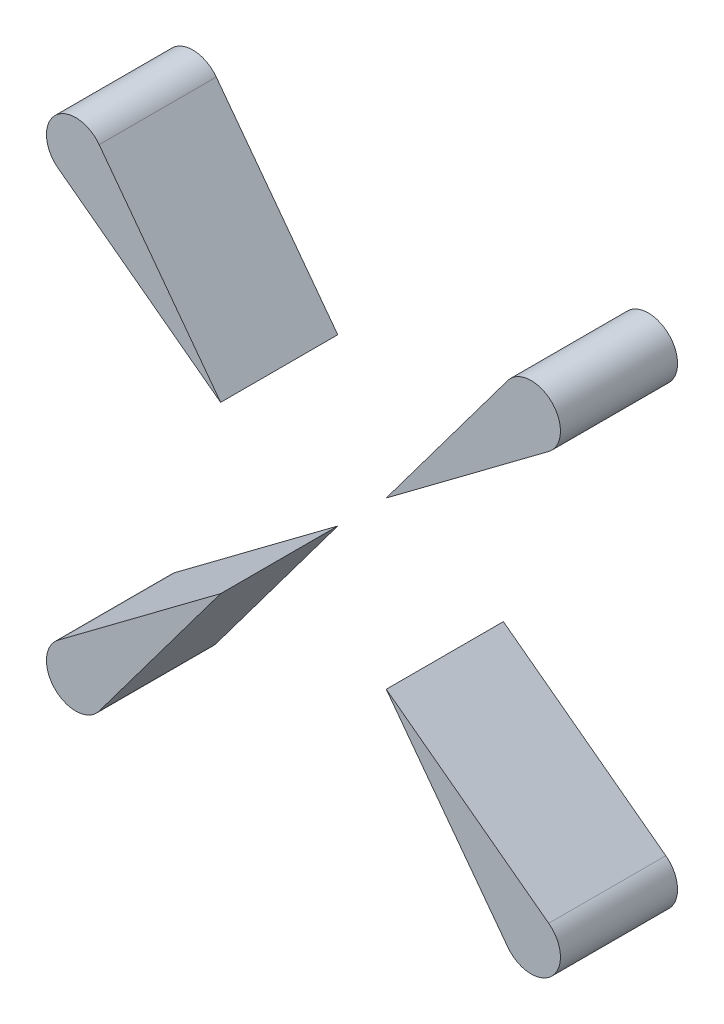
from build123d import *

# Parameters (mm, degrees)
BOSS_EXTRUDE1_DEPTH   = 1
BOSS_EXTRUDE1_2_DEPTH = 1
BOSS_EXTRUDE1_3_DEPTH = 1
BOSS_EXTRUDE1_4_DEPTH = 1


with BuildPart() as part:
    # Sketch1 → Boss-Extrude1 (new body)
    with BuildSketch(Plane.XY):
        with BuildLine():
            Line((0.707106781, 0.707106781), (1.744326282, 2.094253388))
            ThreePointArc((1.744326282, 2.094253388), (2.121320344, 2.121320344), (2.094253388, 1.744326282))
            Line((2.094253388, 1.744326282), (0.707106781, 0.707106781))
        make_face()
    extrude(amount=BOSS_EXTRUDE1_DEPTH)


with BuildPart() as body_2:
    # Sketch1 → Boss-Extrude1 2 (new body)
    with BuildSketch(Plane.XY):
        with BuildLine():
            Line((1.744326282, -2.094253388), (0.707106781, -0.707106781))
            Line((0.707106781, -0.707106781), (2.094253388, -1.744326282))
            ThreePointArc((2.094253388, -1.744326282), (2.121320344, -2.121320344), (1.744326282, -2.094253388))
        make_face()
    extrude(amount=BOSS_EXTRUDE1_2_DEPTH)


with BuildPart() as body_3:
    # Sketch1 → Boss-Extrude1 3 (new body)
    with BuildSketch(Plane.XY):
        with BuildLine():
            Line((-2.094253388, -1.744326282), (-0.707106781, -0.707106781))
            Line((-0.707106781, -0.707106781), (-1.744326282, -2.094253388))
            ThreePointArc((-1.744326282, -2.094253388), (-2.121320344, -2.121320344), (-2.094253388, -1.744326282))
        make_face()
    extrude(amount=BOSS_EXTRUDE1_3_DEPTH)


with BuildPart() as body_4:
    # Sketch1 → Boss-Extrude1 4 (new body)
    with BuildSketch(Plane.XY):
        with BuildLine():
            Line((-1.744326282, 2.094253388), (-0.707106781, 0.707106781))
            Line((-0.707106781, 0.707106781), (-2.094253388, 1.744326282))
            ThreePointArc((-2.094253388, 1.744326282), (-2.121320344, 2.121320344), (-1.744326282, 2.094253388))
        make_face()
    extrude(amount=BOSS_EXTRUDE1_4_DEPTH)


solid = Compound([part.part, body_2.part, body_3.part, body_4.part])
